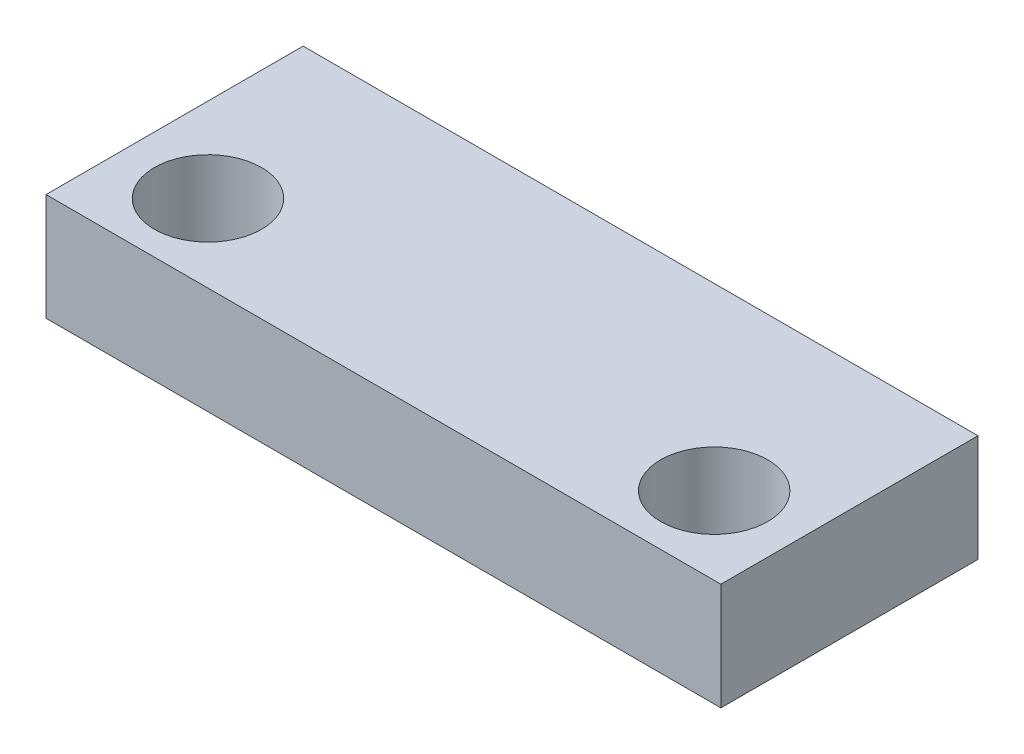
from build123d import *

# Parameters (mm, degrees)
SKETCH2_W           = 19.99996
SKETCH2_H           = 7.62
SKETCH2_R           = 1.5875
BOSS_EXTRUDE1_DEPTH = 3.175


with BuildPart() as part:
    # Sketch2 → Boss-Extrude1 (new body)
    with BuildSketch(Plane(origin=(0, 0, 0), x_dir=(1, 0, 0), z_dir=(0, 1, 0))):
        with Locations((9.99998, 3.81)):
            Rectangle(SKETCH2_W, SKETCH2_H)
        with Locations(Location((17.5006, 2.30124, 0), (0, 0, 270))):
            Circle(SKETCH2_R, mode=Mode.SUBTRACT)
        with Locations(Location((2.49936, 2.30124, 0), (0, 0, 90))):
            Circle(SKETCH2_R, mode=Mode.SUBTRACT)
    extrude(amount=-BOSS_EXTRUDE1_DEPTH)


solid = part.part
